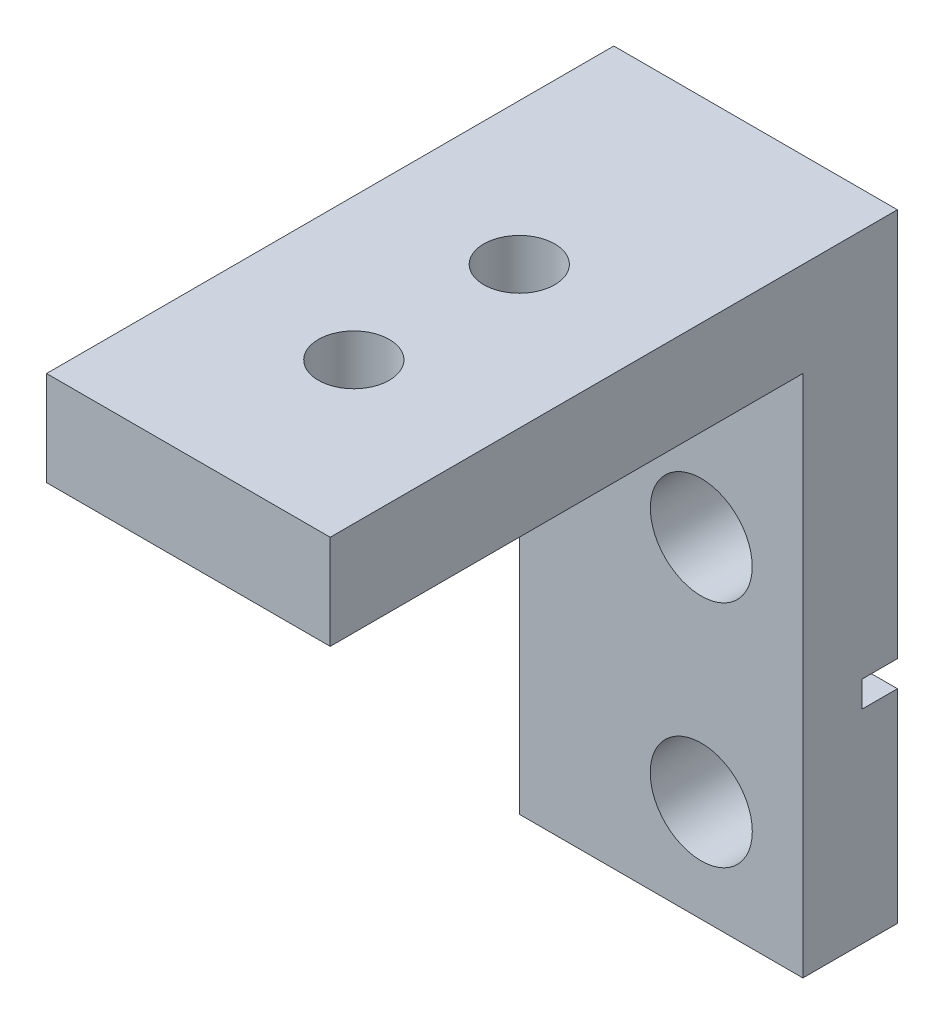
from build123d import *

# Parameters (mm, degrees)
SKETCH_1_W          = 12
SKETCH_1_H          = 22.2
EXTRUDE_1_DEPTH     = 4
SKETCH_2_R          = 2.16
SKETCH_2_R_2        = 2.155
CUT_EXTRUDE_1_DEPTH = 4
CUT_EXTRUDE_2_DEPTH = 1.5
SKETCH_5_W          = 13.387393305
SKETCH_5_H          = 3.9
CUT_EXTRUDE_3_DEPTH = 14.23669143
SKETCH_6_W          = 12
SKETCH_6_H          = 7.85
EXTRUDE_3_DEPTH     = 4
SKETCH_7_W          = 12
SKETCH_7_H          = 4
EXTRUDE_4_DEPTH     = 20
SKETCH_8_R          = 1.5
CUT_EXTRUDE_4_DEPTH = 34.205760042


with BuildPart() as part:
    # 草图1 → 凸台-拉伸1 (new body)
    with BuildSketch(Plane.XY):
        Rectangle(SKETCH_1_W, SKETCH_1_H)
    extrude(amount=EXTRUDE_1_DEPTH)

    # 草图2 → 切除-拉伸1 (cut)
    with BuildSketch(Plane.XY.offset(4)):
        with Locations((1.7, -6.8)):
            Circle(SKETCH_2_R)
        with Locations((1.7, 2.9)):
            Circle(SKETCH_2_R_2)
    extrude(amount=-CUT_EXTRUDE_1_DEPTH, mode=Mode.SUBTRACT)

    # 草图4 → 切除-拉伸2 (cut)
    with BuildSketch(Plane(origin=(0, 0, 0), x_dir=(-1, 0, 0), z_dir=(0, 0, -1))):
        Polygon((-6, -1.4), (-6, -2.5), (-1.7, -2.5), (6, -2.5), (6, -1.4), (-1.7, -1.4), align=None)
    extrude(amount=-CUT_EXTRUDE_2_DEPTH, mode=Mode.SUBTRACT)

    # 草图5 → 切除-拉伸3 (cut, through all)
    with BuildSketch(Plane(origin=(0, 0, 0), x_dir=(-1, 0, 0), z_dir=(0, 0, -1))):
        with Locations((0.693696653, 9.15)):
            Rectangle(SKETCH_5_W, SKETCH_5_H)
    extrude(amount=-CUT_EXTRUDE_3_DEPTH, mode=Mode.SUBTRACT)

    # 草图6 → 凸台-拉伸3 (add)
    with BuildSketch(Plane.XY.offset(4)):
        with Locations((0, 11.125)):
            Rectangle(SKETCH_6_W, SKETCH_6_H)
    extrude(amount=-EXTRUDE_3_DEPTH)

    # 草图7 → 凸台-拉伸4 (add)
    with BuildSketch(Plane.XY.offset(4)):
        with Locations((0, 13.05)):
            Rectangle(SKETCH_7_W, SKETCH_7_H)
    extrude(amount=EXTRUDE_4_DEPTH)

    # 草图8 → 切除-拉伸4 (cut, through all)
    with BuildSketch(Plane.XZ.offset(-11.05)):
        with Locations(Location((0, 10, 0), (0, 0, 270))):
            Circle(SKETCH_8_R)
        with Locations(Location((0, 17, 0), (0, 0, 270))):
            Circle(SKETCH_8_R)
    extrude(amount=-CUT_EXTRUDE_4_DEPTH, mode=Mode.SUBTRACT)


solid = part.part
